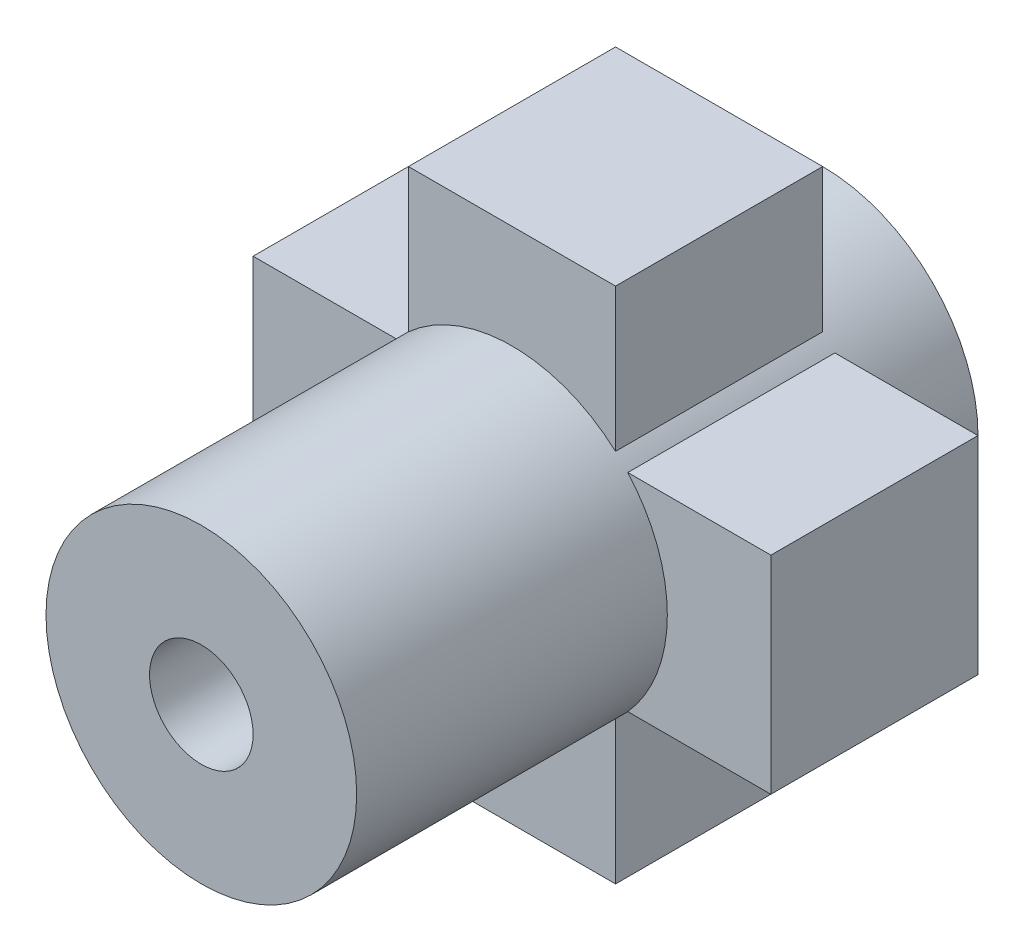
from build123d import *

# Parameters (mm, degrees)
SKETCH1_R                = 7.5
SKETCH1_R_2              = 2.5
BOSS_EXTRUDE1_DEPTH      = 10
BOSS_EXTRUDE2_DEPTH      = 15
BOSS_EXTRUDE2_DEPTH_BACK = 15
SKETCH2_R                = 7.5
SKETCH2_R_2              = 2.5


with BuildPart() as part:
    # Sketch1 → Boss-Extrude1 (new body)
    # profile 1 of 5: a face of its own
    with BuildSketch(Plane.XY):
        with BuildLine():
            Line((-12.5, -5), (-5.590169944, -5))
            ThreePointArc((-5.590169944, -5), (-7.5, 0), (-5.590169944, 5))
            Line((-5.590169944, 5), (-12.5, 5))
            Line((-12.5, 5), (-12.5, -5))
        make_face()
    # profile 2 of 5: a face of its own
    with BuildSketch(Plane.XY):
        with BuildLine():
            ThreePointArc((5, -5.590169944), (0, -7.5), (-5, -5.590169944))
            Line((-5, -5.590169944), (-5, -12.5))
            Line((-5, -12.5), (5, -12.5))
            Line((5, -12.5), (5, -5.590169944))
        make_face()
    # profile 3 of 5: a face of its own
    with BuildSketch(Plane.XY):
        with BuildLine():
            Line((-5, 12.5), (-5, 5.590169944))
            ThreePointArc((-5, 5.590169944), (0, 7.5), (5, 5.590169944))
            Line((5, 5.590169944), (5, 12.5))
            Line((5, 12.5), (-5, 12.5))
        make_face()
    # profile 4 of 5: a face of its own
    with BuildSketch(Plane.XY):
        with BuildLine():
            ThreePointArc((7.5, 0), (7.006292692, -2.676165673), (5.590169944, -5))
            Line((5.590169944, -5), (12.5, -5))
            Line((12.5, -5), (12.5, 5))
            Line((12.5, 5), (5.590169944, 5))
            ThreePointArc((5.590169944, 5), (7.006292692, 2.676165673), (7.5, 0))
        make_face()
    # profile 5 of 5: a face of its own
    with BuildSketch(Plane.XY):
        Circle(SKETCH1_R)
        Circle(SKETCH1_R_2, mode=Mode.SUBTRACT)
    extrude(amount=BOSS_EXTRUDE1_DEPTH)

    # Sketch2 → Boss-Extrude2 (add, two sides: drawn at the far end of the back side and taken through both)
    with BuildSketch(Plane.XY.offset(10).offset(-BOSS_EXTRUDE2_DEPTH_BACK)):
        Circle(SKETCH2_R)
        Circle(SKETCH2_R_2, mode=Mode.SUBTRACT)
    extrude(amount=BOSS_EXTRUDE2_DEPTH + BOSS_EXTRUDE2_DEPTH_BACK)


solid = part.part
